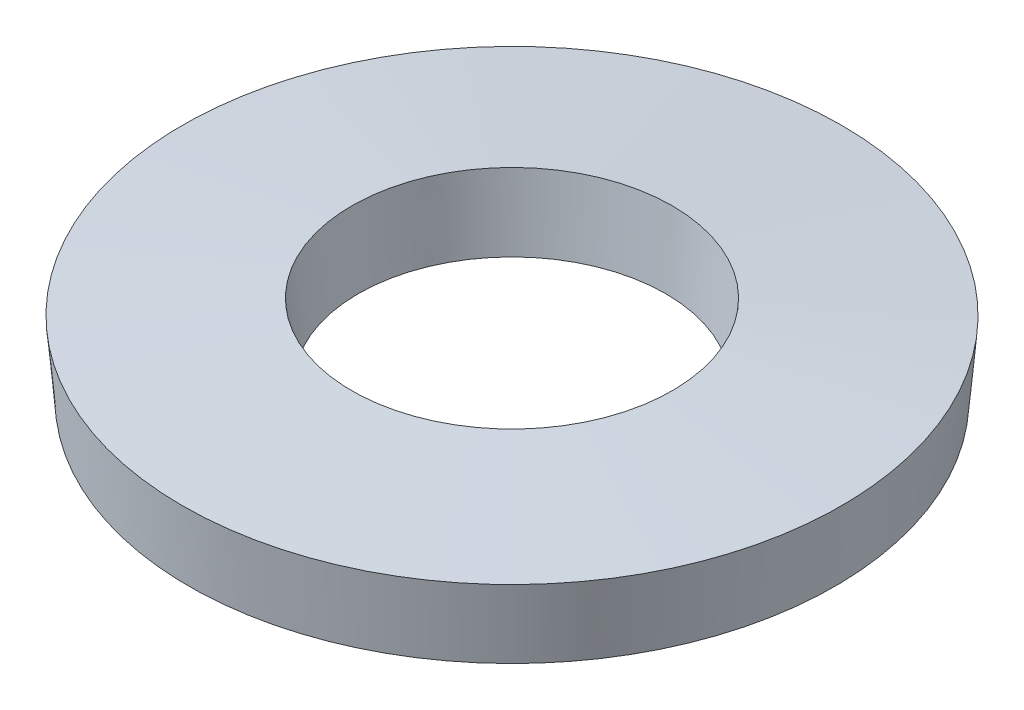
from build123d import *


with BuildPart() as part:
    # Sketch1 → Revolve1 (revolve)
    with BuildSketch(Plane.XY):
        Polygon((8.824341122, 0), (4.2, 0.407728945), (4.375658878, 2.4), (9, 1.992271055), align=None)
    revolve(axis=Axis((0, 0, 0), (0, 1, 0)))


solid = part.part
